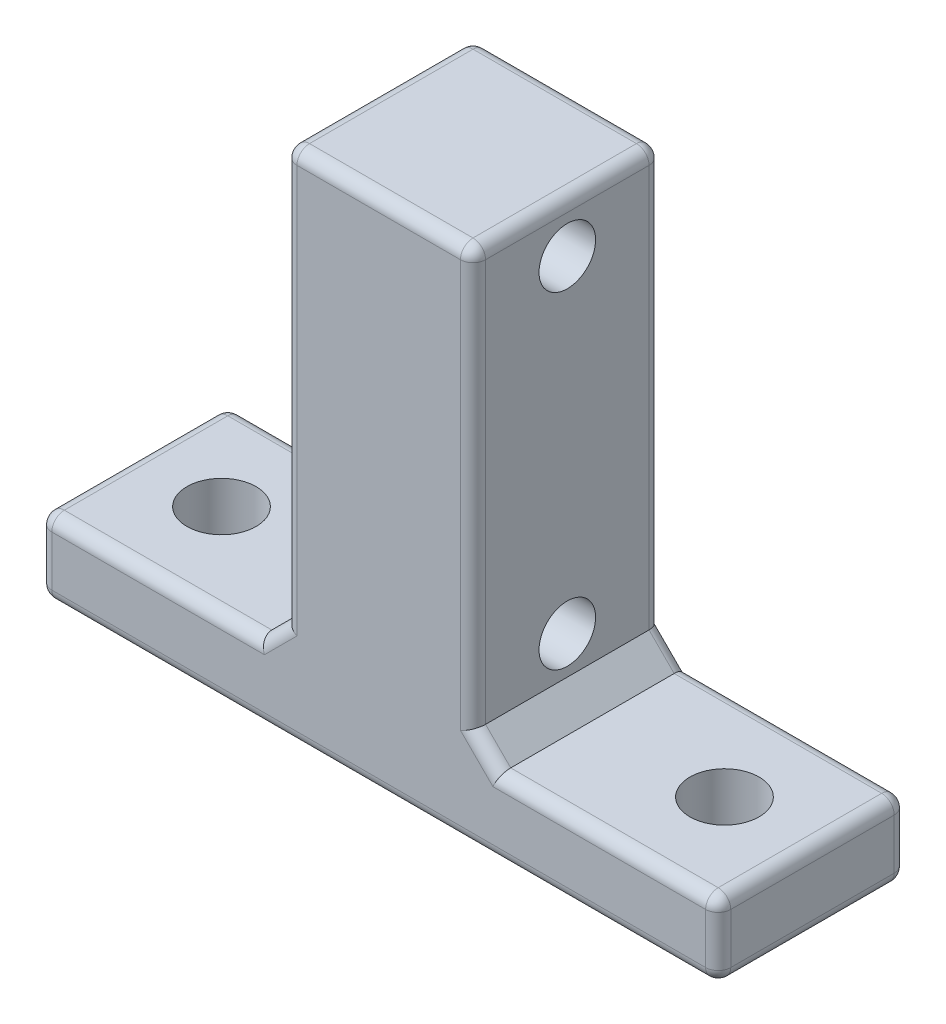
from build123d import *

# Parameters (mm, degrees)
SKETCH_1_W          = 54
SKETCH_1_H          = 15
SKETCH_1_R          = 2.75
EXTRUDE_1_DEPTH     = 6
SKETCH_2_W          = 15
SKETCH_2_H          = 35
EXTRUDE_2_DEPTH     = 7.5
SKETCH_3_R          = 2.25
CUT_EXTRUDE_1_DEPTH = 15
CHAMFER_1_SIZE      = 2
FILLET_1_R          = 1


with BuildPart() as part:
    # 草图1 → 凸台-拉伸1 (new body)
    with BuildSketch(Plane(origin=(0, 0, 0), x_dir=(1, 0, 0), z_dir=(0, 1, 0))):
        Rectangle(SKETCH_1_W, SKETCH_1_H)
        with Locations(Location((-20, 0, 0), (0, 0, 270))):
            Circle(SKETCH_1_R, mode=Mode.SUBTRACT)
        with Locations(Location((20, 0, 0), (0, 0, 270))):
            Circle(SKETCH_1_R, mode=Mode.SUBTRACT)
    extrude(amount=EXTRUDE_1_DEPTH)

    # 草图2 → 凸台-拉伸2 (add, symmetric)
    with BuildSketch(Plane.XY):
        with Locations((0, 23.5)):
            Rectangle(SKETCH_2_W, SKETCH_2_H)
    extrude(amount=EXTRUDE_2_DEPTH, both=True)

    # 草图3 → 切除-拉伸1 (cut)
    with BuildSketch(Plane.ZY.offset(7.5)):
        with Locations(Location((0, 11, 0), (0, 0, 270))):
            Circle(SKETCH_3_R)
        with Locations(Location((0, 37, 0), (0, 0, 270))):
            Circle(SKETCH_3_R)
    extrude(amount=-CUT_EXTRUDE_1_DEPTH, mode=Mode.SUBTRACT)

    # 倒角1
    chamfer_1_edges = [part.edges().sort_by_distance(p)[0] for p in [
        (7.5, 6, 0),
        (-7.5, 6, 0),
    ]]
    chamfer(chamfer_1_edges, length=CHAMFER_1_SIZE)

    # 圆角1
    fillet_1_edges = [part.edges().sort_by_distance(p)[0] for p in [
        (-27, 6, 0),
        (-18.25, 6, 7.5),
        (0, 41, -7.5),
        (7.5, 41, 0),
        (-7.5, 24.5, -7.5),
        (-7.5, 41, 0),
        (0, 41, 7.5),
        (-7.5, 24.5, 7.5),
        (7.5, 24.5, -7.5),
        (7.5, 24.5, 7.5),
        (18.25, 6, 7.5),
        (-18.25, 6, -7.5),
        (27, 6, 0),
        (0, 0, 7.5),
        (8.5, 7, -7.5),
        (8.5, 7, 7.5),
        (-8.5, 7, -7.5),
        (-8.5, 7, 7.5),
        (-27, 0, 0),
        (0, 0, -7.5),
        (27, 0, 0),
        (27, 3, 7.5),
        (-27, 3, 7.5),
        (-27, 3, -7.5),
        (27, 3, -7.5),
        (18.25, 6, -7.5),
    ]]
    fillet(fillet_1_edges, radius=FILLET_1_R)


solid = part.part
